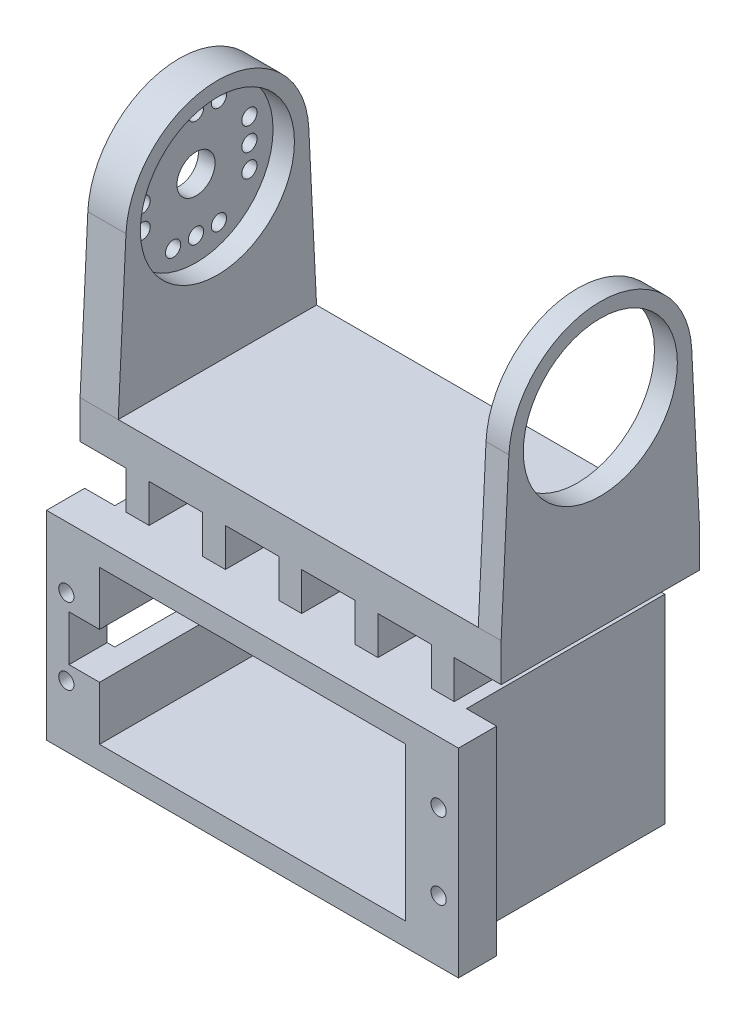
from build123d import *

# Parameters (mm, degrees)
SKETCH1_W           = 46.1
SKETCH1_H           = 26.1
SKETCH1_W_2         = 40.1
SKETCH1_H_2         = 20.1
BOSS_EXTRUDE1_DEPTH = 28
SKETCH2_W           = 46.1
SKETCH2_H           = 26.1
BOSS_EXTRUDE2_DEPTH = 3
SKETCH3_W           = 3.95
SKETCH3_H           = 26.1
BOSS_EXTRUDE3_DEPTH = 5
SKETCH4_R           = 1
CUT_EXTRUDE1_DEPTH  = 13
SKETCH5_R           = 10
BOSS_EXTRUDE4_DEPTH = 2
SKETCH7_W           = 3
SKETCH7_H           = 26
BOSS_EXTRUDE5_DEPTH = 5
SKETCH8_W           = 55.2
SKETCH8_H           = 26
BOSS_EXTRUDE6_DEPTH = 5
BOSS_EXTRUDE7_DEPTH = 55.2
SKETCH12_R          = 2.5
SKETCH12_R_2        = 1
CUT_EXTRUDE2_DEPTH  = 13.2
SKETCH13_R          = 10.1
CUT_EXTRUDE3_DEPTH  = 13.2
SKETCH14_W          = 47.2
SKETCH14_H          = 32
CUT_EXTRUDE4_DEPTH  = 43.2
SKETCH15_R          = 10.1
CUT_EXTRUDE5_DEPTH  = 2.8
SKETCH16_W          = 4
SKETCH16_H          = 6
CUT_EXTRUDE6_DEPTH  = 24


with BuildPart() as part:
    # Sketch1 → Boss-Extrude1 (new body)
    with BuildSketch(Plane.XY):
        Rectangle(SKETCH1_W, SKETCH1_H)
        Rectangle(SKETCH1_W_2, SKETCH1_H_2, mode=Mode.SUBTRACT)
    extrude(amount=BOSS_EXTRUDE1_DEPTH)

    # Sketch2 → Boss-Extrude2 (add)
    with BuildSketch(Plane(origin=(0, 0, 0), x_dir=(-1, 0, 0), z_dir=(0, 0, -1))):
        Rectangle(SKETCH2_W, SKETCH2_H)
    extrude(amount=BOSS_EXTRUDE2_DEPTH)

    # Sketch3 → Boss-Extrude3 (add)
    with BuildSketch(Plane.XY.offset(28)):
        with Locations((-25.025, 0)):
            Rectangle(SKETCH3_W, SKETCH3_H)
        with Locations((25.025, 0)):
            Rectangle(SKETCH3_W, SKETCH3_H)
    extrude(amount=-BOSS_EXTRUDE3_DEPTH)

    # Sketch4 → Cut-Extrude1 (cut)
    with BuildSketch(Plane.XY.offset(28)):
        with Locations((24.4, 5)):
            Circle(SKETCH4_R)
        with Locations((24.4, -5)):
            Circle(SKETCH4_R)
    cut_extrude1 = extrude(amount=-CUT_EXTRUDE1_DEPTH, mode=Mode.SUBTRACT)

    # Mirror1: Cut-Extrude1 across plane
    add(cut_extrude1.mirror(Plane(origin=(0, 0, 0), x_dir=(0, 0, 1), z_dir=(1, 0, 0))), mode=Mode.SUBTRACT)

    # Sketch5 → Boss-Extrude4 (add)
    with BuildSketch(Plane(origin=(0, 0, -3), x_dir=(-1, 0, 0), z_dir=(0, 0, -1))):
        with Locations((10.05, 0)):
            Circle(SKETCH5_R)
    extrude(amount=BOSS_EXTRUDE4_DEPTH)

    # Sketch7 → Boss-Extrude5 (add)
    with BuildSketch(Plane(origin=(0, 13.05, 0), x_dir=(1, 0, 0), z_dir=(0, 1, 0))):
        with Locations((-20.05, -10)):
            Rectangle(SKETCH7_W, SKETCH7_H)
        with Locations((-10.05, -10)):
            Rectangle(SKETCH7_W, SKETCH7_H)
        with Locations((-0.05, -10)):
            Rectangle(SKETCH7_W, SKETCH7_H)
        with Locations((9.95, -10)):
            Rectangle(SKETCH7_W, SKETCH7_H)
        with Locations((19.95, -10)):
            Rectangle(SKETCH7_W, SKETCH7_H)
    extrude(amount=BOSS_EXTRUDE5_DEPTH)

    # Sketch8 → Boss-Extrude6 (add)
    with BuildSketch(Plane(origin=(0, 18.05, 0), x_dir=(1, 0, 0), z_dir=(0, 1, 0))):
        with Locations((0, -10)):
            Rectangle(SKETCH8_W, SKETCH8_H)
    extrude(amount=BOSS_EXTRUDE6_DEPTH)

    # Sketch9 → Boss-Extrude7 (add)
    with BuildSketch(Plane.ZY.offset(27.6)):
        with BuildLine():
            Line((-3, 23.05), (-1.985460019, 43.640549012))
            ThreePointArc((-1.985460019, 43.640549012), (10, 55.05), (21.985460019, 43.640549012))
            Line((21.985460019, 43.640549012), (23, 23.05))
            Line((23, 23.05), (-3, 23.05))
        make_face()
    extrude(amount=-BOSS_EXTRUDE7_DEPTH)

    # Sketch12 → Cut-Extrude2 (cut)
    with BuildSketch(Plane.ZY.offset(27.6)):
        with Locations((10, 43.05)):
            Circle(SKETCH12_R)
        with Locations((10, 50.05)):
            Circle(SKETCH12_R_2)
        with Locations((13, 50.05)):
            Circle(SKETCH12_R_2)
        with Locations((7, 50.05)):
            Circle(SKETCH12_R_2)
        with Locations((17, 46.05)):
            Circle(SKETCH12_R_2)
        with Locations((17, 43.05)):
            Circle(SKETCH12_R_2)
        with Locations((17, 40.05)):
            Circle(SKETCH12_R_2)
        with Locations((13, 36.05)):
            Circle(SKETCH12_R_2)
        with Locations((10, 36.05)):
            Circle(SKETCH12_R_2)
        with Locations((7, 36.05)):
            Circle(SKETCH12_R_2)
        with Locations((3, 40.05)):
            Circle(SKETCH12_R_2)
        with Locations((3, 43.05)):
            Circle(SKETCH12_R_2)
        with Locations((3, 46.05)):
            Circle(SKETCH12_R_2)
    extrude(amount=-CUT_EXTRUDE2_DEPTH, mode=Mode.SUBTRACT)

    # Sketch13 → Cut-Extrude3 (cut)
    with BuildSketch(Plane(origin=(27.6, 0, 0), x_dir=(0, 0, -1), z_dir=(1, 0, 0))):
        with Locations((-10, 43.05)):
            Circle(SKETCH13_R)
    extrude(amount=-CUT_EXTRUDE3_DEPTH, mode=Mode.SUBTRACT)

    # Sketch14 → Cut-Extrude4 (cut)
    with BuildSketch(Plane(origin=(0, 0, -3), x_dir=(-1, 0, 0), z_dir=(0, 0, -1))):
        with Locations((-1, 39.05)):
            Rectangle(SKETCH14_W, SKETCH14_H)
    extrude(amount=-CUT_EXTRUDE4_DEPTH, mode=Mode.SUBTRACT)

    # Sketch15 → Cut-Extrude5 (cut)
    with BuildSketch(Plane(origin=(-22.6, 0, 0), x_dir=(0, 0, -1), z_dir=(1, 0, 0))):
        with Locations((-10, 43.05)):
            Circle(SKETCH15_R)
    extrude(amount=-CUT_EXTRUDE5_DEPTH, mode=Mode.SUBTRACT)

    # Sketch16 → Cut-Extrude6 (cut)
    with BuildSketch(Plane.XY.offset(28)):
        with Locations((-22.05, 0)):
            Rectangle(SKETCH16_W, SKETCH16_H)
    extrude(amount=-CUT_EXTRUDE6_DEPTH, mode=Mode.SUBTRACT)


solid = part.part
